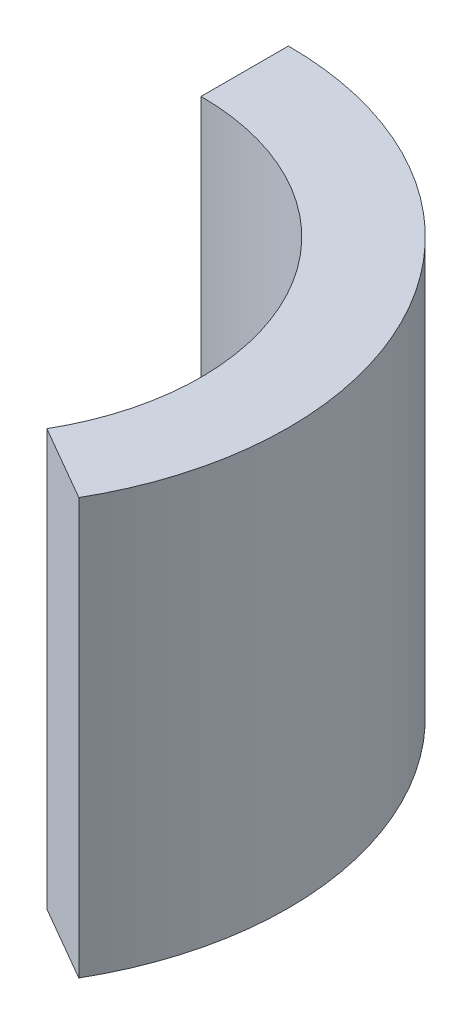
from build123d import *

# Parameters (mm, degrees)
BOSS_EXTRUDE1_DEPTH = 19.05


with BuildPart() as part:
    # Sketch1 → Boss-Extrude1 (new body)
    with BuildSketch(Plane(origin=(0, 0, 0), x_dir=(1, 0, 0), z_dir=(0, 1, 0))):
        with BuildLine():
            ThreePointArc((15.135, 0), (10.702061133, 10.702061133), (0, 15.135))
            Line((0, 15.135), (0, 11.135))
            ThreePointArc((0, 11.135), (7.873634009, 7.873634009), (11.135, 0))
            ThreePointArc((11.135, 0), (10.755584076, -2.881950067), (9.643192871, -5.5675))
            Line((9.643192871, -5.5675), (13.107294486, -7.5675))
            ThreePointArc((13.107294486, -7.5675), (14.619287381, -3.917226248), (15.135, 0))
        make_face()
    extrude(amount=BOSS_EXTRUDE1_DEPTH)


solid = part.part
